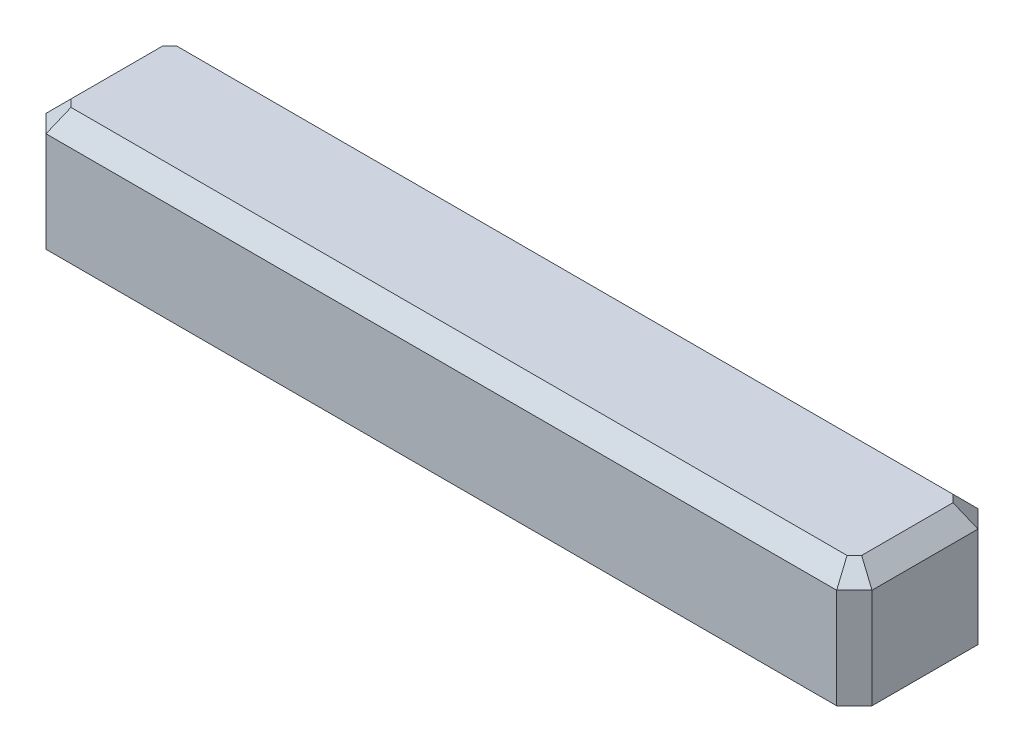
from build123d import *

# Parameters (mm, degrees)
BOSS_EXTRUDE1_DEPTH = 10
CHAMFER1_SIZE       = 1.5
SKETCH2_W           = 61.34
SKETCH2_H           = 3.8
CUT_EXTRUDE1_DEPTH  = 7


with BuildPart() as part:
    # Sketch1 → Boss-Extrude1 (new body)
    with BuildSketch(Plane(origin=(0, 0, 0), x_dir=(1, 0, 0), z_dir=(0, 1, 0))):
        Polygon((-35.07, 4.5), (-33.57, 6), (33.57, 6), (35.07, 4.5), (35.07, -4.5), (33.57, -6), (-33.57, -6), (-35.07, -4.5), align=None)
    extrude(amount=BOSS_EXTRUDE1_DEPTH)

    # Chamfer1
    chamfer1_edges = [part.edges().sort_by_distance(p)[0] for p in [
        (0, 10, 6),
        (34.32, 10, 5.25),
        (35.07, 10, 0),
        (34.32, 10, -5.25),
        (0, 10, -6),
        (-34.32, 10, -5.25),
        (-35.07, 10, 0),
        (-34.32, 10, 5.25),
    ]]
    chamfer(chamfer1_edges, length=CHAMFER1_SIZE)

    # Sketch2 → Cut-Extrude1 (cut)
    with BuildSketch(Plane.XZ):
        with Locations((0, -1.1)):
            Rectangle(SKETCH2_W, SKETCH2_H)
    extrude(amount=-CUT_EXTRUDE1_DEPTH, mode=Mode.SUBTRACT)


solid = part.part
